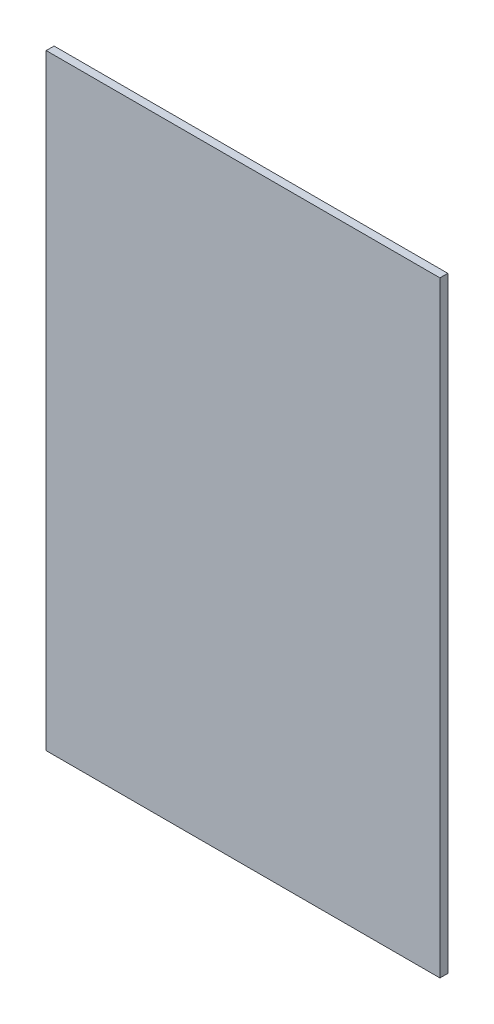
from build123d import *

# Parameters (mm, degrees)
BOSS_EXTRUDE1_DEPTH      = 15
BOSS_EXTRUDE1_DEPTH_BACK = 139
SKETCH1_W                = 100
SKETCH1_H                = 2


with BuildPart() as part:
    # Sketch1 → Boss-Extrude1 (new, two sides: drawn at the far end of the back side and taken through both)
    with BuildSketch(Plane(origin=(0, 0, 0), x_dir=(1, 0, 0), z_dir=(0, 1, 0)).offset(-BOSS_EXTRUDE1_DEPTH_BACK)):
        with Locations((50, 1)):
            Rectangle(SKETCH1_W, SKETCH1_H)
    extrude(amount=BOSS_EXTRUDE1_DEPTH + BOSS_EXTRUDE1_DEPTH_BACK)


solid = part.part
